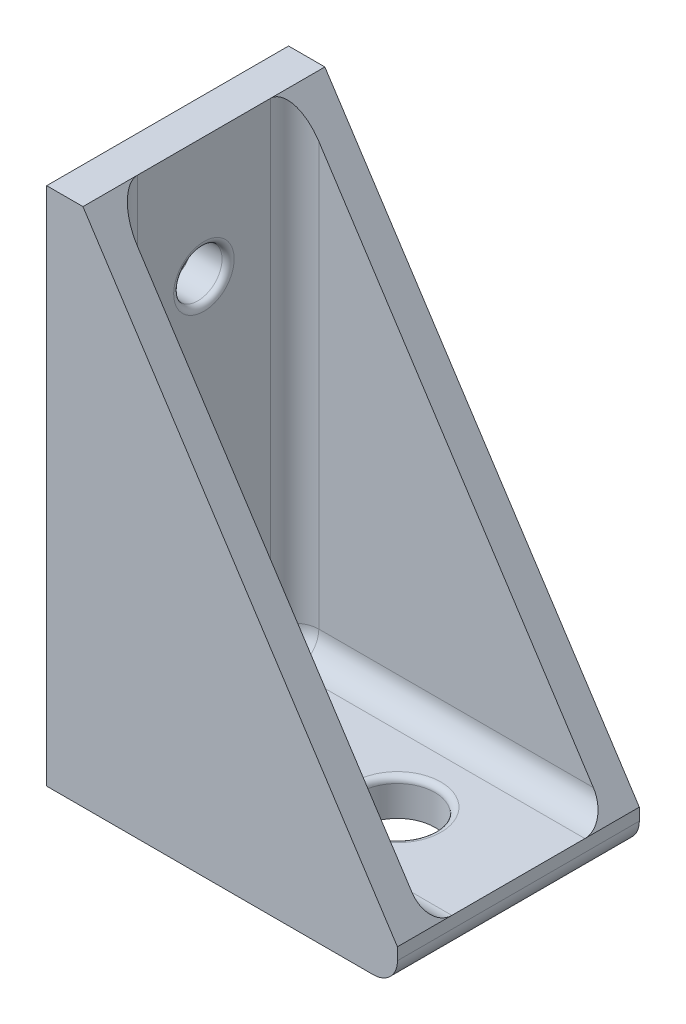
from build123d import *

# Parameters (mm, degrees)
BOSS_EXTRUDE1_DEPTH = 20
BOSS_EXTRUDE2_DEPTH = 2.5
BOSS_EXTRUDE3_DEPTH = 2.5
SKETCH4_R           = 2
CUT_EXTRUDE1_DEPTH  = 55.083269132
SKETCH6_R           = 3.1
CUT_EXTRUDE2_DEPTH  = 56.587768439
FILLET1_R           = 2
FILLET2_R           = 0.5


with BuildPart() as part:
    # Sketch1 → Boss-Extrude1 (new body)
    with BuildSketch(Plane.XY):
        Polygon((0, 43), (0, 0), (29, 0), (29, 3), (3, 3), (3, 43), align=None)
    extrude(amount=BOSS_EXTRUDE1_DEPTH)

    # Sketch2 → Boss-Extrude2 (add)
    with BuildSketch(Plane.XY.offset(20)):
        Polygon((3, 43), (29, 3), (3, 3), align=None)
    extrude(amount=-BOSS_EXTRUDE2_DEPTH)

    # Sketch3 → Boss-Extrude3 (add)
    with BuildSketch(Plane(origin=(0, 0, 0), x_dir=(-1, 0, 0), z_dir=(0, 0, -1))):
        Polygon((-3, 43), (-29, 3), (-3, 3), align=None)
    extrude(amount=-BOSS_EXTRUDE3_DEPTH)

    # Sketch4 → Cut-Extrude1 (cut, through all)
    with BuildSketch(Plane(origin=(3, 0, 0), x_dir=(0, 0, -1), z_dir=(1, 0, 0))):
        with Locations(Location((-10, 33, 0), (0, 0, 90))):
            Circle(SKETCH4_R)
        with Locations(Location((-10, 13, 0), (0, 0, 90))):
            Circle(SKETCH4_R)
    extrude(amount=-CUT_EXTRUDE1_DEPTH, mode=Mode.SUBTRACT)

    # Sketch6 → Cut-Extrude2 (cut, through all)
    with BuildSketch(Plane.XZ):
        with Locations(Location((19, 10, 0), (0, 0, 270))):
            Circle(SKETCH6_R)
    extrude(amount=-CUT_EXTRUDE2_DEPTH, mode=Mode.SUBTRACT)

    # Fillet1
    fillet1_edges = [part.edges().sort_by_distance(p)[0] for p in [
        (29, 0, 10),
        (3, 3, 10),
        (3, 23, 17.5),
        (16, 3, 17.5),
        (3, 23, 2.5),
        (16, 3, 2.5),
    ]]
    fillet(fillet1_edges, radius=FILLET1_R)

    # Fillet2
    fillet2_edges = [part.edges().sort_by_distance(p)[0] for p in [
        (3, 31, 10),
        (3, 11, 10),
        (19, 3, 13.1),
    ]]
    fillet(fillet2_edges, radius=FILLET2_R)


solid = part.part
